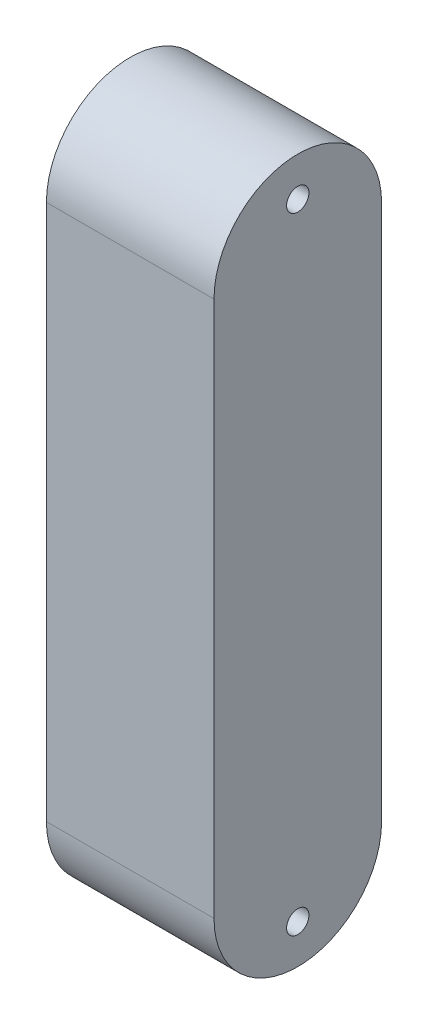
from build123d import *

# Parameters (mm, degrees)
SKETCH1_W           = 15
SKETCH1_H           = 15
BOSS_EXTRUDE1_DEPTH = 63
SKETCH3_R           = 1
CUT_EXTRUDE1_DEPTH  = 15
FILLET1_RADIUS      = 7.5
FILLET1_LENGTH      = 15
FILLET2_RADIUS      = 7.5
FILLET2_LENGTH      = 15


with BuildPart() as part:
    # Sketch1 → Boss-Extrude1 (new body)
    with BuildSketch(Plane(origin=(0, 0, 0), x_dir=(1, 0, 0), z_dir=(0, 1, 0))):
        Rectangle(SKETCH1_W, SKETCH1_H)
    extrude(amount=BOSS_EXTRUDE1_DEPTH)

    # Sketch3 → Cut-Extrude1 (cut)
    with BuildSketch(Plane(origin=(7.5, 0, 0), x_dir=(0, 0, -1), z_dir=(1, 0, 0))):
        with Locations((0, 59.5)):
            Circle(SKETCH3_R)
        with Locations((0, 3.5)):
            Circle(SKETCH3_R)
    extrude(amount=-CUT_EXTRUDE1_DEPTH, mode=Mode.SUBTRACT)

    # Fillet1: full round fillet: the end face becomes a half cylinder, R = half its width
    fillet1_face = Plane((0, 63, 0), x_dir=(1, 0, 0), z_dir=(0, 1, 0))  # on the end face: x along it, z out of the body
    fillet1_slab = fillet1_face.offset(-FILLET1_RADIUS / 2) * Box(FILLET1_LENGTH, 2 * FILLET1_RADIUS, FILLET1_RADIUS, mode=Mode.PRIVATE)  # the body's end, R deep
    fillet1_round = Plane((0, 55.5, 0), x_dir=(0, 1, 0), z_dir=(1, 0, 0)) * Cylinder(FILLET1_RADIUS, FILLET1_LENGTH, mode=Mode.PRIVATE)  # its axis R under the face
    add(fillet1_slab - fillet1_round, mode=Mode.SUBTRACT)

    # Fillet2: full round fillet: the end face becomes a half cylinder, R = half its width
    fillet2_face = Plane((0, 0, 0), x_dir=(-1, 0, 0), z_dir=(0, -1, 0))  # on the end face: x along it, z out of the body
    fillet2_slab = fillet2_face.offset(-FILLET2_RADIUS / 2) * Box(FILLET2_LENGTH, 2 * FILLET2_RADIUS, FILLET2_RADIUS, mode=Mode.PRIVATE)  # the body's end, R deep
    fillet2_round = Plane((0, 7.5, 0), x_dir=(0, -1, 0), z_dir=(-1, 0, 0)) * Cylinder(FILLET2_RADIUS, FILLET2_LENGTH, mode=Mode.PRIVATE)  # its axis R under the face
    add(fillet2_slab - fillet2_round, mode=Mode.SUBTRACT)


solid = part.part
